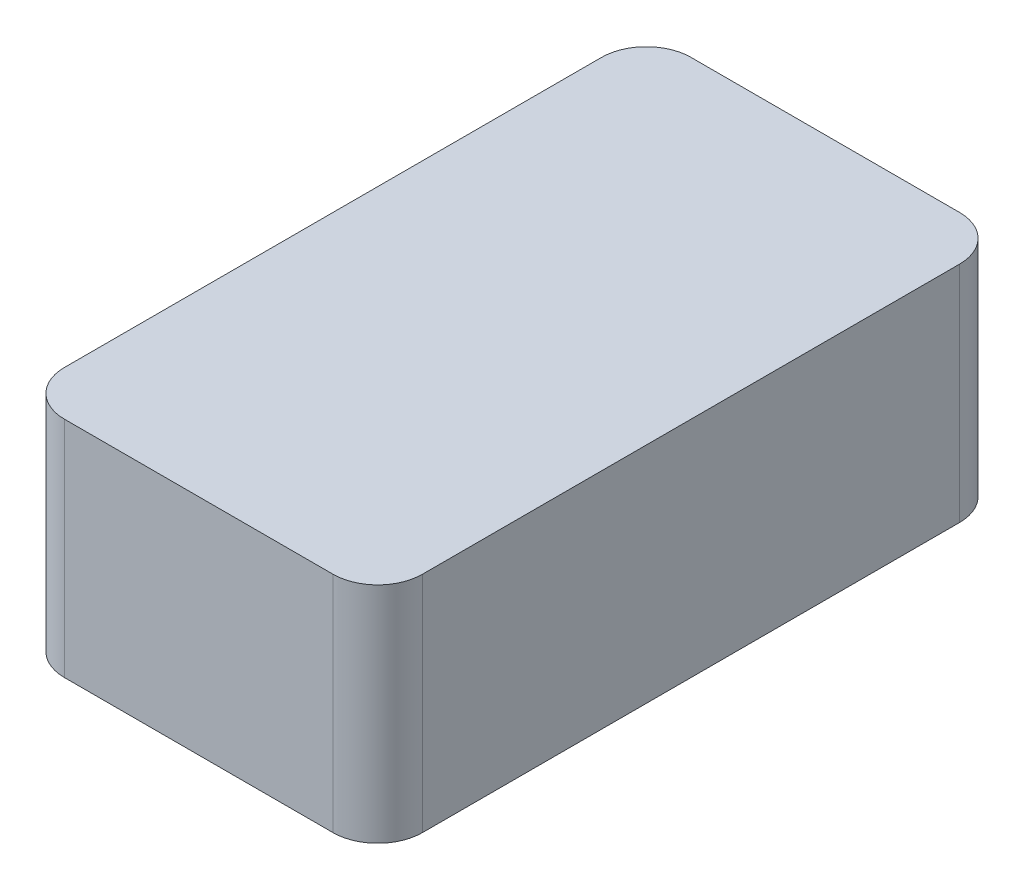
from build123d import *

# Parameters (mm, degrees)
SKETCH_1_W      = 80
SKETCH_1_H      = 140
EXTRUDE_1_DEPTH = 50
FILLET_1_R      = 10


with BuildPart() as part:
    # 草圖1 → 填料-伸長1 (new body)
    with BuildSketch(Plane(origin=(0, 0, 0), x_dir=(1, 0, 0), z_dir=(0, 1, 0))):
        Rectangle(SKETCH_1_W, SKETCH_1_H)
    extrude(amount=EXTRUDE_1_DEPTH)

    # 圓角1
    fillet_1_edges = [part.edges().sort_by_distance(p)[0] for p in [
        (40, 25, 70),
        (-40, 25, 70),
        (-40, 25, -70),
        (40, 25, -70),
    ]]
    fillet(fillet_1_edges, radius=FILLET_1_R)


solid = part.part
